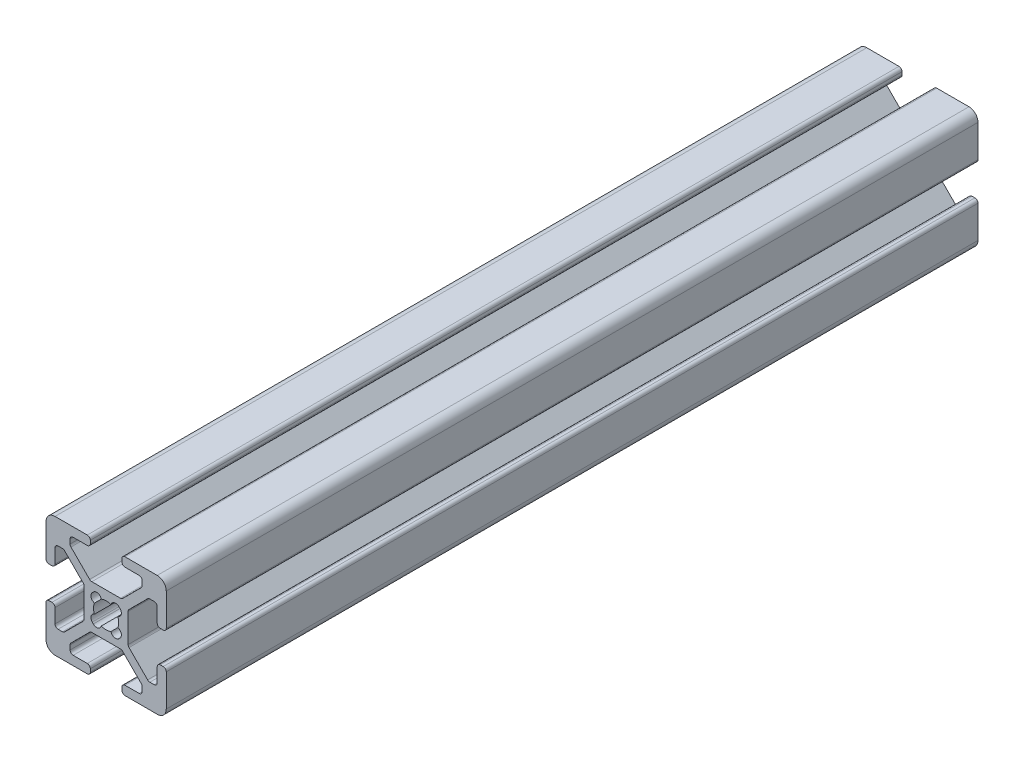
from build123d import *

# Parameters (mm, degrees)
EXTRUDE1_DEPTH = 135


with BuildPart() as part:
    # Sketch1 → Extrude1 (new body)
    with BuildSketch(Plane.XY):
        with BuildLine():
            Line((-5.032287798, -0.341059771), (-5.516287798, -0.341059771))
            ThreePointArc((-5.516287798, -0.341059771), (-5.875498042, -0.192270016), (-6.024287798, 0.166940229))
            Line((-6.024287798, 0.166940229), (-6.024287798, 2.515940229))
            ThreePointArc((-6.024287798, 2.515940229), (-6.173077553, 2.875150474), (-6.532287798, 3.023940229))
            Line((-6.532287798, 3.023940229), (-7.258207136, 3.023940229))
            ThreePointArc((-7.258207136, 3.023940229), (-7.45261032, 2.985271032), (-7.617417381, 2.875150474))
            Line((-7.617417381, 2.875150474), (-10.720498042, -0.227930187))
            ThreePointArc((-10.720498042, -0.227930187), (-10.8306186, -0.392737249), (-10.869287798, -0.587140432))
            Line((-10.869287798, -0.587140432), (-10.869287798, -5.354979109))
            ThreePointArc((-10.869287798, -5.354979109), (-10.8306186, -5.549382293), (-10.720498042, -5.714189354))
            Line((-10.720498042, -5.714189354), (-7.617417381, -8.817270016))
            ThreePointArc((-7.617417381, -8.817270016), (-7.45261032, -8.927390573), (-7.258207136, -8.966059771))
            Line((-7.258207136, -8.966059771), (-6.532287798, -8.966059771))
            ThreePointArc((-6.532287798, -8.966059771), (-6.173077553, -8.817270016), (-6.024287798, -8.458059771))
            Line((-6.024287798, -8.458059771), (-6.024287798, -6.109059771))
            ThreePointArc((-6.024287798, -6.109059771), (-5.875498042, -5.749849526), (-5.516287798, -5.601059771))
            Line((-5.516287798, -5.601059771), (-5.032287798, -5.601059771))
            ThreePointArc((-5.032287798, -5.601059771), (-4.673077553, -5.749849526), (-4.524287798, -6.109059771))
            Line((-4.524287798, -6.109059771), (-4.524287798, -11.471059771))
            ThreePointArc((-4.524287798, -11.471059771), (-4.963627626, -12.531719943), (-6.024287798, -12.971059771))
            Line((-6.024287798, -12.971059771), (-11.386287798, -12.971059771))
            ThreePointArc((-11.386287798, -12.971059771), (-11.745498042, -12.822270016), (-11.894287798, -12.463059771))
            Line((-11.894287798, -12.463059771), (-11.894287798, -11.979059771))
            ThreePointArc((-11.894287798, -11.979059771), (-11.745498042, -11.619849526), (-11.386287798, -11.471059771))
            Line((-11.386287798, -11.471059771), (-9.037287798, -11.471059771))
            ThreePointArc((-9.037287798, -11.471059771), (-8.678077553, -11.322270016), (-8.529287798, -10.963059771))
            Line((-8.529287798, -10.963059771), (-8.529287798, -10.237140432))
            ThreePointArc((-8.529287798, -10.237140432), (-8.567956995, -10.042737249), (-8.678077553, -9.877930187))
            Line((-8.678077553, -9.877930187), (-11.781158214, -6.774849526))
            ThreePointArc((-11.781158214, -6.774849526), (-11.945965275, -6.664728968), (-12.140368459, -6.626059771))
            Line((-12.140368459, -6.626059771), (-16.908207136, -6.626059771))
            ThreePointArc((-16.908207136, -6.626059771), (-17.10261032, -6.664728968), (-17.267417381, -6.774849526))
            Line((-17.267417381, -6.774849526), (-20.370498042, -9.877930187))
            ThreePointArc((-20.370498042, -9.877930187), (-20.4806186, -10.042737249), (-20.519287798, -10.237140432))
            Line((-20.519287798, -10.237140432), (-20.519287798, -10.963059771))
            ThreePointArc((-20.519287798, -10.963059771), (-20.370498042, -11.322270016), (-20.011287798, -11.471059771))
            Line((-20.011287798, -11.471059771), (-17.662287798, -11.471059771))
            ThreePointArc((-17.662287798, -11.471059771), (-17.303077553, -11.619849526), (-17.154287798, -11.979059771))
            Line((-17.154287798, -11.979059771), (-17.154287798, -12.463059771))
            ThreePointArc((-17.154287798, -12.463059771), (-17.303077553, -12.822270016), (-17.662287798, -12.971059771))
            Line((-17.662287798, -12.971059771), (-23.024287798, -12.971059771))
            ThreePointArc((-23.024287798, -12.971059771), (-24.084947969, -12.531719943), (-24.524287798, -11.471059771))
            Line((-24.524287798, -11.471059771), (-24.524287798, -6.109059771))
            ThreePointArc((-24.524287798, -6.109059771), (-24.375498042, -5.749849526), (-24.016287798, -5.601059771))
            Line((-24.016287798, -5.601059771), (-23.532287798, -5.601059771))
            ThreePointArc((-23.532287798, -5.601059771), (-23.173077553, -5.749849526), (-23.024287798, -6.109059771))
            Line((-23.024287798, -6.109059771), (-23.024287798, -8.458059771))
            ThreePointArc((-23.024287798, -8.458059771), (-22.875498042, -8.817270016), (-22.516287798, -8.966059771))
            Line((-22.516287798, -8.966059771), (-21.790368459, -8.966059771))
            ThreePointArc((-21.790368459, -8.966059771), (-21.595965275, -8.927390573), (-21.431158214, -8.817270016))
            Line((-21.431158214, -8.817270016), (-18.328077553, -5.714189354))
            ThreePointArc((-18.328077553, -5.714189354), (-18.217956995, -5.549382293), (-18.179287798, -5.354979109))
            Line((-18.179287798, -5.354979109), (-18.179287798, -0.587140432))
            ThreePointArc((-18.179287798, -0.587140432), (-18.217956995, -0.392737249), (-18.328077553, -0.227930187))
            Line((-18.328077553, -0.227930187), (-21.431158214, 2.875150474))
            ThreePointArc((-21.431158214, 2.875150474), (-21.595965275, 2.985271032), (-21.790368459, 3.023940229))
            Line((-21.790368459, 3.023940229), (-22.516287798, 3.023940229))
            ThreePointArc((-22.516287798, 3.023940229), (-22.875498042, 2.875150474), (-23.024287798, 2.515940229))
            Line((-23.024287798, 2.515940229), (-23.024287798, 0.166940229))
            ThreePointArc((-23.024287798, 0.166940229), (-23.173077553, -0.192270016), (-23.532287798, -0.341059771))
            Line((-23.532287798, -0.341059771), (-24.016287798, -0.341059771))
            ThreePointArc((-24.016287798, -0.341059771), (-24.375498042, -0.192270016), (-24.524287798, 0.166940229))
            Line((-24.524287798, 0.166940229), (-24.524287798, 5.528940229))
            ThreePointArc((-24.524287798, 5.528940229), (-24.084947969, 6.589600401), (-23.024287798, 7.028940229))
            Line((-23.024287798, 7.028940229), (-17.662287798, 7.028940229))
            ThreePointArc((-17.662287798, 7.028940229), (-17.303077553, 6.880150474), (-17.154287798, 6.520940229))
            Line((-17.154287798, 6.520940229), (-17.154287798, 6.036940229))
            ThreePointArc((-17.154287798, 6.036940229), (-17.303077553, 5.677729984), (-17.662287798, 5.528940229))
            Line((-17.662287798, 5.528940229), (-20.011287798, 5.528940229))
            ThreePointArc((-20.011287798, 5.528940229), (-20.370498042, 5.380150474), (-20.519287798, 5.020940229))
            Line((-20.519287798, 5.020940229), (-20.519287798, 4.295020891))
            ThreePointArc((-20.519287798, 4.295020891), (-20.4806186, 4.100617707), (-20.370498042, 3.935810646))
            Line((-20.370498042, 3.935810646), (-17.267417381, 0.832729984))
            ThreePointArc((-17.267417381, 0.832729984), (-17.10261032, 0.722609427), (-16.908207136, 0.683940229))
            Line((-16.908207136, 0.683940229), (-12.140368459, 0.683940229))
            ThreePointArc((-12.140368459, 0.683940229), (-11.945965275, 0.722609427), (-11.781158214, 0.832729984))
            Line((-11.781158214, 0.832729984), (-8.678077553, 3.935810646))
            ThreePointArc((-8.678077553, 3.935810646), (-8.567956995, 4.100617707), (-8.529287798, 4.295020891))
            Line((-8.529287798, 4.295020891), (-8.529287798, 5.020940229))
            ThreePointArc((-8.529287798, 5.020940229), (-8.678077553, 5.380150474), (-9.037287798, 5.528940229))
            Line((-9.037287798, 5.528940229), (-11.386287798, 5.528940229))
            ThreePointArc((-11.386287798, 5.528940229), (-11.745498042, 5.677729984), (-11.894287798, 6.036940229))
            Line((-11.894287798, 6.036940229), (-11.894287798, 6.520940229))
            ThreePointArc((-11.894287798, 6.520940229), (-11.745498042, 6.880150474), (-11.386287798, 7.028940229))
            Line((-11.386287798, 7.028940229), (-6.024287798, 7.028940229))
            ThreePointArc((-6.024287798, 7.028940229), (-4.963627626, 6.589600401), (-4.524287798, 5.528940229))
            Line((-4.524287798, 5.528940229), (-4.524287798, 0.166940229))
            ThreePointArc((-4.524287798, 0.166940229), (-4.673077553, -0.192270016), (-5.032287798, -0.341059771))
        make_face()
        with BuildLine():
            Line((-12.399386954, -5.275565737), (-12.219781831, -5.095960615))
            ThreePointArc((-12.219781831, -5.095960615), (-12.018349781, -4.327527582), (-12.589154291, -3.775036489))
            ThreePointArc((-12.589154291, -3.775036489), (-12.428787798, -2.971059771), (-12.589154291, -2.167083053))
            ThreePointArc((-12.589154291, -2.167083053), (-12.018349781, -1.61459196), (-12.219781831, -0.846158927))
            Line((-12.219781831, -0.846158927), (-12.399386954, -0.666553805))
            ThreePointArc((-12.399386954, -0.666553805), (-13.167819987, -0.465121754), (-13.72031108, -1.035926265))
            ThreePointArc((-13.72031108, -1.035926265), (-14.524287798, -0.875559771), (-15.328264516, -1.035926265))
            ThreePointArc((-15.328264516, -1.035926265), (-15.880755608, -0.465121754), (-16.649188641, -0.666553805))
            Line((-16.649188641, -0.666553805), (-16.828793764, -0.846158927))
            ThreePointArc((-16.828793764, -0.846158927), (-17.030225814, -1.61459196), (-16.459421304, -2.167083053))
            ThreePointArc((-16.459421304, -2.167083053), (-16.619787798, -2.971059771), (-16.459421304, -3.775036489))
            ThreePointArc((-16.459421304, -3.775036489), (-17.030225814, -4.327527582), (-16.828793764, -5.095960615))
            Line((-16.828793764, -5.095960615), (-16.649188641, -5.275565737))
            ThreePointArc((-16.649188641, -5.275565737), (-15.880755608, -5.476997788), (-15.328264516, -4.906193277))
            ThreePointArc((-15.328264516, -4.906193277), (-14.524287798, -5.066559771), (-13.72031108, -4.906193277))
            ThreePointArc((-13.72031108, -4.906193277), (-13.167819987, -5.476997788), (-12.399386954, -5.275565737))
        make_face(mode=Mode.SUBTRACT)
    extrude(amount=EXTRUDE1_DEPTH)


solid = part.part
